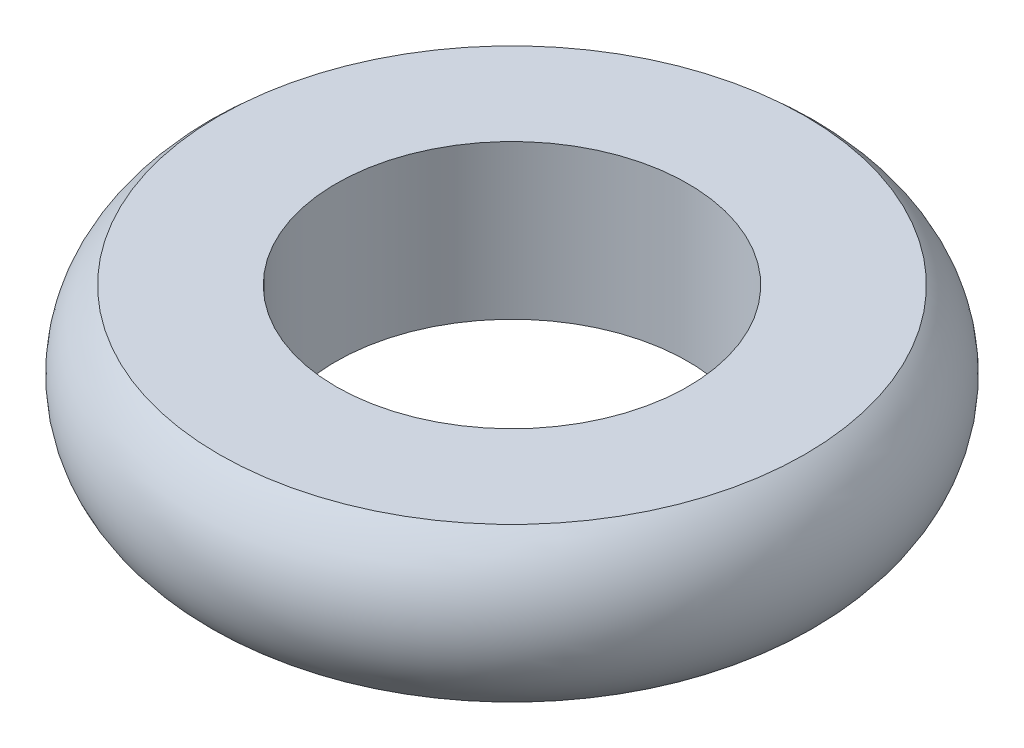
from build123d import *

# Parameters (mm, degrees)
SKETCH3_R          = 1.6
CUT_EXTRUDE2_DEPTH = 5.2


with BuildPart() as part:
    # Sketch1 → Revolve1 (revolve)
    with BuildSketch(Plane.XY, mode=Mode.PRIVATE) as revolve1_sk:
        with BuildLine():
            Line((-2.1, 0.7), (-1.534314575, 0.7))
            ThreePointArc((-1.534314575, 0.7), (-1.2, 0), (-1.534314575, -0.7))
            Line((-1.534314575, -0.7), (-2.1, -0.7))
            Line((-2.1, -0.7), (-2.665685425, -0.7))
            ThreePointArc((-2.665685425, -0.7), (-3, 0), (-2.665685425, 0.7))
            Line((-2.665685425, 0.7), (-2.1, 0.7))
        make_face()
    revolve(revolve1_sk.sketch.rotate(Axis((0, 0, 0), (0, 1, 0)), 270), axis=Axis((0, 0, 0), (0, 1, 0)))

    # Sketch3 → Cut-Extrude2 (cut)
    with BuildSketch(Plane(origin=(0, 2, 0), x_dir=(1, 0, 0), z_dir=(0, 1, 0))):
        with Locations(Location((0, 0, 0), (0, 0, 270))):
            Circle(SKETCH3_R)
    extrude(amount=-CUT_EXTRUDE2_DEPTH, mode=Mode.SUBTRACT)


solid = part.part
